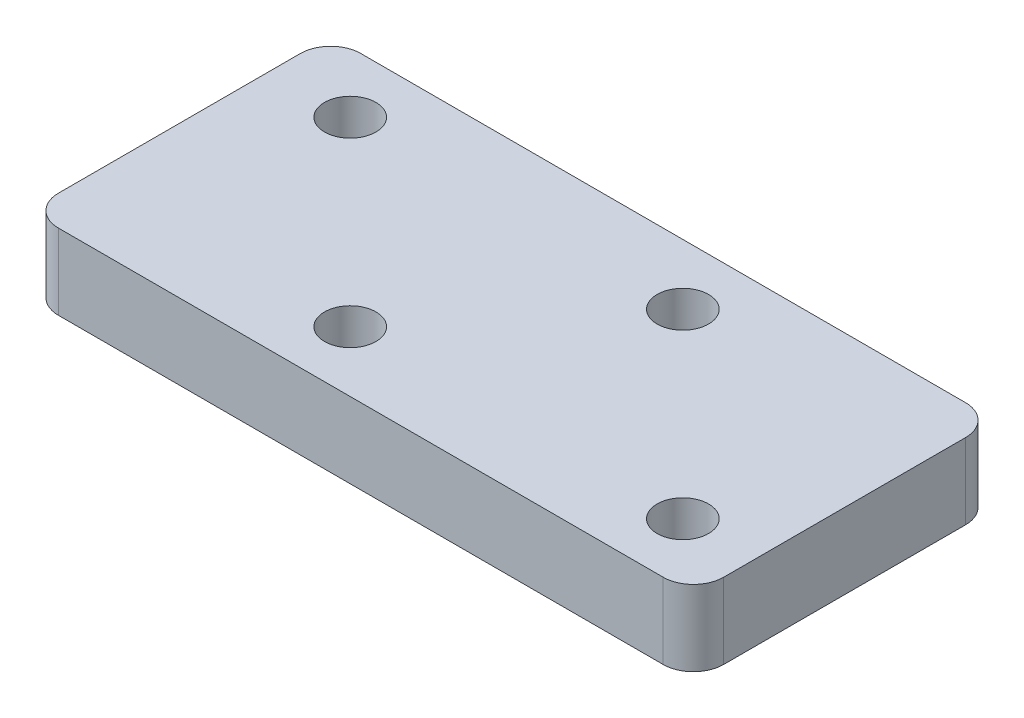
from build123d import *

# Parameters (mm, degrees)
SKETCH_1_W      = 44
SKETCH_1_H      = 20
SKETCH_1_R      = 1.7
EXTRUDE_1_DEPTH = 5
FILLET_1_R      = 2


with BuildPart() as part:
    # 草图1 → 凸台-拉伸1 (new body)
    with BuildSketch(Plane(origin=(0, 0, 0), x_dir=(1, 0, 0), z_dir=(0, 1, 0))):
        with Locations((22, 10)):
            Rectangle(SKETCH_1_W, SKETCH_1_H)
        with Locations(Location((5.3, 16, 0), (0, 0, 270))):
            Circle(SKETCH_1_R, mode=Mode.SUBTRACT)
        with Locations(Location((17.3, 4, 0), (0, 0, 270))):
            Circle(SKETCH_1_R, mode=Mode.SUBTRACT)
        with Locations(Location((27.3, 16, 0), (0, 0, 270))):
            Circle(SKETCH_1_R, mode=Mode.SUBTRACT)
        with Locations(Location((39.3, 4, 0), (0, 0, 270))):
            Circle(SKETCH_1_R, mode=Mode.SUBTRACT)
    extrude(amount=EXTRUDE_1_DEPTH)

    # 圆角1
    fillet_1_edges = [part.edges().sort_by_distance(p)[0] for p in [
        (0, 2.5, -20),
        (44, 2.5, -20),
        (44, 2.5, 0),
        (0, 2.5, 0),
    ]]
    fillet(fillet_1_edges, radius=FILLET_1_R)


solid = part.part
